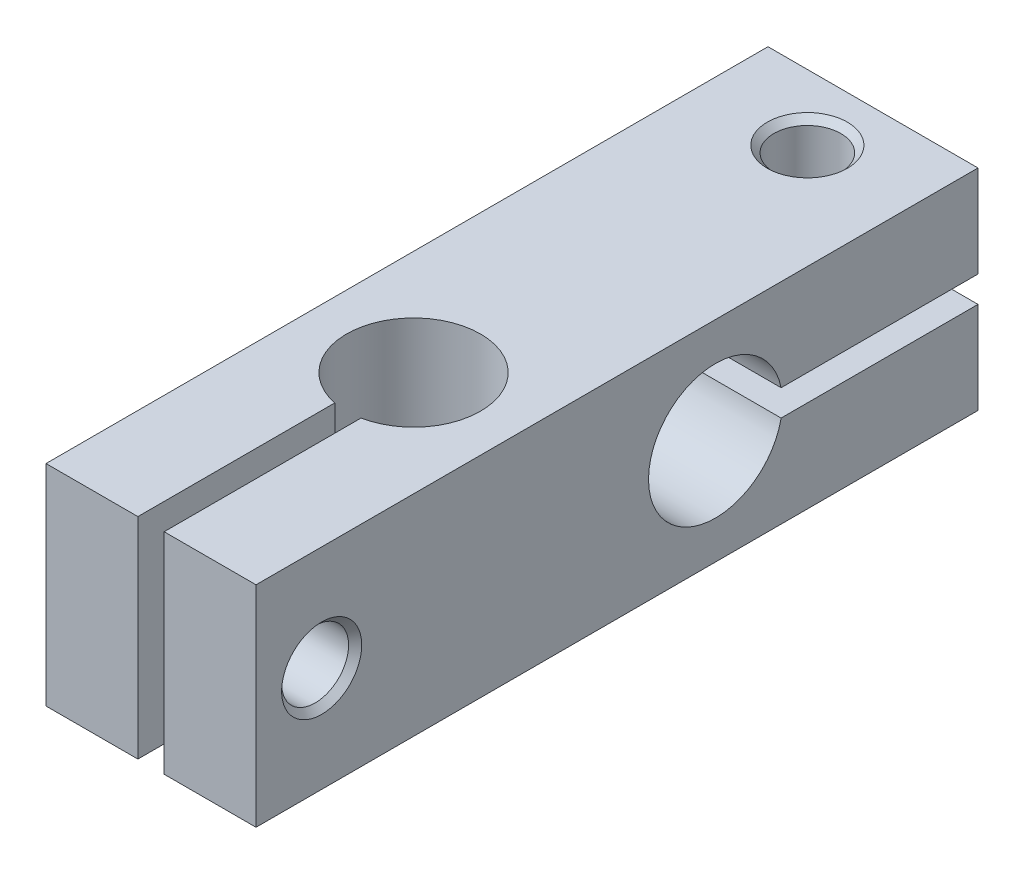
from build123d import *

# Parameters (mm, degrees)
SKETCH1_W                                 = 16
SKETCH1_H                                 = 16
BASE_DEPTH                                = 55
SKETCH2_W                                 = 2
SKETCH2_H                                 = 16
RODSLOT_DEPTH                             = 58.835974964
F_5_1_5_1_FREE_HOLE_FOR_SCREW_D           = 5.1
F_5_1_5_1_FREE_HOLE_FOR_SCREW_DEPTH       = 7.5
F_5_1_5_1_FREE_HOLE_FOR_SCREW_CSINK_D     = 6.1
F_5_1_5_1_FREE_HOLE_FOR_SCREW_CSINK_ANGLE = 90
F_5_1_5_1_FREE_HOLE_FOR_SCREW_TIP         = 1.056244584
M5X0_8_TAPPED_HOLE_FOR_ROD_SCREW_D        = 4.2
M5X0_8_TAPPED_HOLE_FOR_ROD_SCREW_DEPTH    = 7.6381927
M5X0_8_TAPPED_HOLE_FOR_ROD_SCREW_TIP      = 1.2618073
F_10_2_10_2_ROD_HOLE_D                    = 10.2
SKETCH13_W                                = 20
SKETCH13_H                                = 2
ROD2SLOT_DEPTH                            = 58.835974964
F_10_2_10_2_ROD2_HOLE_D                   = 10.2
F_5_1_5_1_DIAMETER_HOLE1_D                = 5.1
F_5_1_5_1_DIAMETER_HOLE1_DEPTH            = 7.5
F_5_1_5_1_DIAMETER_HOLE1_CSINK_D          = 6.1
F_5_1_5_1_DIAMETER_HOLE1_CSINK_ANGLE      = 90
F_5_1_5_1_DIAMETER_HOLE1_TIP              = 1.056244584
M5X0_8_TAPPED_HOLE1_D                     = 4.2
M5X0_8_TAPPED_HOLE1_DEPTH                 = 7.6381927
M5X0_8_TAPPED_HOLE1_TIP                   = 1.2618073


with BuildPart() as part:
    # Sketch1 → Base (new body)
    with BuildSketch(Plane.XY):
        Rectangle(SKETCH1_W, SKETCH1_H)
    extrude(amount=BASE_DEPTH)

    # Sketch2 → RodSlot (cut, through all)
    with BuildSketch(Plane(origin=(0, 8, 0), x_dir=(1, 0, 0), z_dir=(0, 1, 0))):
        with Locations((0, -47)):
            Rectangle(SKETCH2_W, SKETCH2_H)
    extrude(amount=-RODSLOT_DEPTH, mode=Mode.SUBTRACT)

    # Ø5.1 (5.1) free hole for screw
    with Locations(Plane(origin=(8, 0, 0), x_dir=(0, 0, -1), z_dir=(1, 0, 0))):
        with Locations((-50, 0)):
            CounterSinkHole(F_5_1_5_1_FREE_HOLE_FOR_SCREW_D / 2, F_5_1_5_1_FREE_HOLE_FOR_SCREW_CSINK_D / 2, depth=F_5_1_5_1_FREE_HOLE_FOR_SCREW_DEPTH, counter_sink_angle=F_5_1_5_1_FREE_HOLE_FOR_SCREW_CSINK_ANGLE)
            with Locations((0, 0, -(F_5_1_5_1_FREE_HOLE_FOR_SCREW_DEPTH + F_5_1_5_1_FREE_HOLE_FOR_SCREW_TIP / 2))):  # 135° drill point
                Cone(0, F_5_1_5_1_FREE_HOLE_FOR_SCREW_D / 2, F_5_1_5_1_FREE_HOLE_FOR_SCREW_TIP, mode=Mode.SUBTRACT)

    # M5x0.8 Tapped Hole for rod screw
    with Locations(Plane.ZY.offset(8)):
        with Locations((50, 0)):
            Hole(M5X0_8_TAPPED_HOLE_FOR_ROD_SCREW_D / 2, depth=M5X0_8_TAPPED_HOLE_FOR_ROD_SCREW_DEPTH)
            with Locations((0, 0, -(M5X0_8_TAPPED_HOLE_FOR_ROD_SCREW_DEPTH + M5X0_8_TAPPED_HOLE_FOR_ROD_SCREW_TIP / 2))):  # 118° drill point
                Cone(0, M5X0_8_TAPPED_HOLE_FOR_ROD_SCREW_D / 2, M5X0_8_TAPPED_HOLE_FOR_ROD_SCREW_TIP, mode=Mode.SUBTRACT)

    # Ø10.2 (10.2) Rod Hole (through all)
    with Locations(Plane(origin=(0, 8, 0), x_dir=(1, 0, 0), z_dir=(0, 1, 0))):
        with Locations((0, -35)):
            Hole(F_10_2_10_2_ROD_HOLE_D / 2)

    # Sketch13 → Rod2Slot (cut, through all)
    with BuildSketch(Plane.ZY.offset(8)):
        with Locations((10, 0)):
            Rectangle(SKETCH13_W, SKETCH13_H)
    extrude(amount=-ROD2SLOT_DEPTH, mode=Mode.SUBTRACT)

    # Ø10.2 (10.2) Rod2 Hole (through all)
    with Locations(Plane(origin=(-8, 0, 0), x_dir=(0, 1, 0), z_dir=(-1, 0, 0))):
        with Locations((0, -20)):
            Hole(F_10_2_10_2_ROD2_HOLE_D / 2)

    # Ø5.1 (5.1) Diameter Hole1
    with Locations(Plane(origin=(0, 8, 0), x_dir=(0, 0, -1), z_dir=(0, 1, 0))):
        with Locations((-5, 0)):
            CounterSinkHole(F_5_1_5_1_DIAMETER_HOLE1_D / 2, F_5_1_5_1_DIAMETER_HOLE1_CSINK_D / 2, depth=F_5_1_5_1_DIAMETER_HOLE1_DEPTH, counter_sink_angle=F_5_1_5_1_DIAMETER_HOLE1_CSINK_ANGLE)
            with Locations((0, 0, -(F_5_1_5_1_DIAMETER_HOLE1_DEPTH + F_5_1_5_1_DIAMETER_HOLE1_TIP / 2))):  # 135° drill point
                Cone(0, F_5_1_5_1_DIAMETER_HOLE1_D / 2, F_5_1_5_1_DIAMETER_HOLE1_TIP, mode=Mode.SUBTRACT)

    # M5x0.8 Tapped Hole1
    with Locations(Plane(origin=(0, -8, 0), x_dir=(-1, 0, 0), z_dir=(0, -1, 0))):
        with Locations((0, -5)):
            Hole(M5X0_8_TAPPED_HOLE1_D / 2, depth=M5X0_8_TAPPED_HOLE1_DEPTH)
            with Locations((0, 0, -(M5X0_8_TAPPED_HOLE1_DEPTH + M5X0_8_TAPPED_HOLE1_TIP / 2))):  # 118° drill point
                Cone(0, M5X0_8_TAPPED_HOLE1_D / 2, M5X0_8_TAPPED_HOLE1_TIP, mode=Mode.SUBTRACT)


solid = part.part
